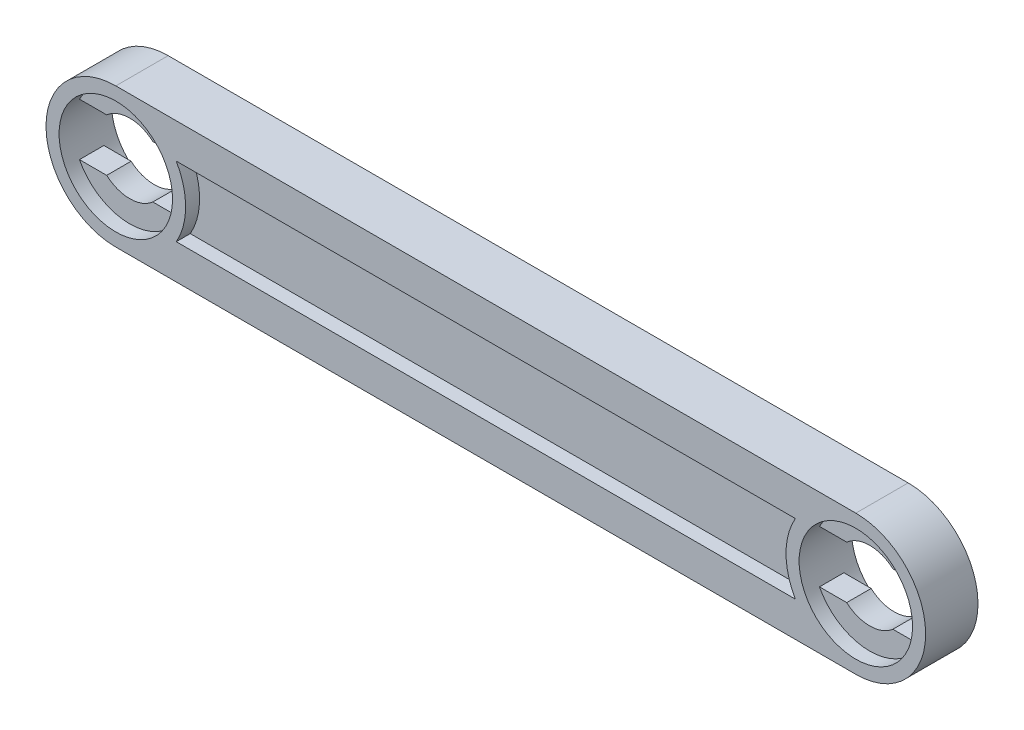
from build123d import *

# Parameters (mm, degrees)
EXTRUDE_1_DEPTH        = 3
CUT_EXTRUDE_1_REACH    = 48.669
SKETCH_3_R             = 3.25
CUT_EXTRUDE_2_DEPTH    = 0.8
CUT_EXTRUDE_START      = -2.2
SKETCH_3_2_R           = 3.25
CUT_EXTRUDE_3_DEPTH    = 0.8
PATTERN_LINEAR_1_COUNT = 2
PATTERN_LINEAR_1_PITCH = 42.4
CUT_EXTRUDE_4_DEPTH    = 0.8
SKETCH_5_W             = 34.4
SKETCH_5_H             = 4
CUT_EXTRUDE_5_DEPTH    = 0.8


with BuildPart() as part:
    # 草图1 → 凸台-拉伸1 (new body)
    with BuildSketch(Plane.XY):
        with BuildLine():
            Line((0, 4), (42.4, 4))
            ThreePointArc((42.4, 4), (46.4, 0), (42.4, -4))
            Line((42.4, -4), (0, -4))
            ThreePointArc((0, -4), (-4, 0), (0, 4))
        make_face()
    extrude(amount=-EXTRUDE_1_DEPTH)

    # 草图2 → 切除-拉伸1 (cut, up to next)
    with BuildSketch(Plane.XY, mode=Mode.PRIVATE) as cut_extrude_1_sk1:
        with BuildLine():
            Line((1.322875656, -1.5), (2.883140649, -1.5))
            ThreePointArc((2.883140649, -1.5), (3.25, 0), (2.883140649, 1.5))
            Line((2.883140649, 1.5), (1.322875656, 1.5))
            ThreePointArc((1.322875656, 1.5), (0, 2), (-1.322875656, 1.5))
            Line((-1.322875656, 1.5), (-2.883140649, 1.5))
            ThreePointArc((-2.883140649, 1.5), (-3.25, 0), (-2.883140649, -1.5))
            Line((-2.883140649, -1.5), (-1.322875656, -1.5))
            ThreePointArc((-1.322875656, -1.5), (0, -2), (1.322875656, -1.5))
        make_face()
    cut_extrude_1_tool1 = extrude(cut_extrude_1_sk1.sketch, amount=-CUT_EXTRUDE_1_REACH, mode=Mode.PRIVATE) & part.part
    cut_extrude_1 = cut_extrude_1_tool1.solids().sort_by_distance((0, 0, 0))[0]
    add(cut_extrude_1, mode=Mode.SUBTRACT)

    # 草图3 → 切除-拉伸2 (cut)
    with BuildSketch(Plane.XY):
        Circle(SKETCH_3_R)
    cut_extrude_2 = extrude(amount=-CUT_EXTRUDE_2_DEPTH, mode=Mode.SUBTRACT)

    # 草图3<2> → 切除-拉伸3 (cut)
    with BuildSketch(Plane.XY.offset(CUT_EXTRUDE_START)):
        Circle(SKETCH_3_2_R)
    cut_extrude_3 = extrude(amount=-CUT_EXTRUDE_3_DEPTH, mode=Mode.SUBTRACT)

    # 阵列(线性)1: 切除-拉伸1, 切除-拉伸2, 切除-拉伸3 ×2
    with Locations(*[(i * PATTERN_LINEAR_1_PITCH, 0, 0) for i in range(1, PATTERN_LINEAR_1_COUNT)]):
        add(cut_extrude_1, mode=Mode.SUBTRACT)
        add(cut_extrude_2, mode=Mode.SUBTRACT)
        add(cut_extrude_3, mode=Mode.SUBTRACT)

    # 草图4 → 切除-拉伸4 (cut)
    with BuildSketch(Plane.XY):
        with BuildLine():
            Line((3.464101615, -2), (38.935898385, -2))
            ThreePointArc((38.935898385, -2), (38.4, 0), (38.935898385, 2))
            Line((38.935898385, 2), (3.464101615, 2))
            ThreePointArc((3.464101615, 2), (4, 0), (3.464101615, -2))
        make_face()
    extrude(amount=-CUT_EXTRUDE_4_DEPTH, mode=Mode.SUBTRACT)

    # 草图5 → 切除-拉伸5 (cut)
    with BuildSketch(Plane(origin=(0, 0, -3), x_dir=(-1, 0, 0), z_dir=(0, 0, -1))):
        with Locations((-21.2, 0)):
            Rectangle(SKETCH_5_W, SKETCH_5_H)
    extrude(amount=-CUT_EXTRUDE_5_DEPTH, mode=Mode.SUBTRACT)


solid = part.part
